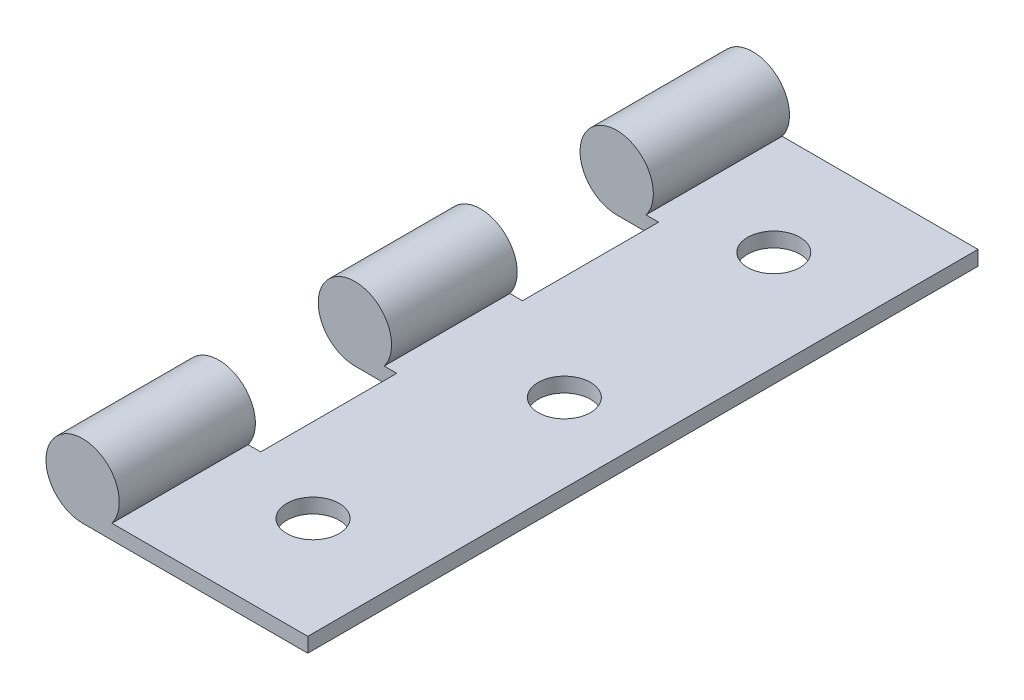
from build123d import *

# Parameters (mm, degrees)
BOSS_EXTRUDE1_DEPTH = 64
SKETCH2_R           = 2.499999953
CUT_EXTRUDE2_DEPTH  = 5
SKETCH3_W           = 8.000000002
SKETCH3_H           = 13
CUT_EXTRUDE3_DEPTH  = 15


with BuildPart() as part:
    # Sketch1 → Boss-Extrude1 (new body)
    with BuildSketch(Plane.XY):
        with BuildLine():
            Line((0, 0), (21.499999926, 0))
            Line((21.499999926, 0), (21.499999926, 1.4))
            Line((21.499999926, 1.4), (2.799999992, 1.4))
            ThreePointArc((2.799999992, 1.4), (-1.565247581, 6.630495138), (0, 0))
        make_face()
    extrude(amount=BOSS_EXTRUDE1_DEPTH)

    # Sketch2 → Cut-Extrude2 (cut)
    with BuildSketch(Plane(origin=(0, 0, 0), x_dir=(1, 0, 0), z_dir=(0, 1, 0))):
        with Locations(Location((11.999999876, -53.99999995, 0), (0, 0, 90))):
            Circle(SKETCH2_R)
        with Locations(Location((13.999999876, -32.000000008, 0), (0, 0, 90))):
            Circle(SKETCH2_R)
        with Locations(Location((11.999999876, -10.000000066, 0), (0, 0, 90))):
            Circle(SKETCH2_R)
    extrude(amount=CUT_EXTRUDE2_DEPTH, mode=Mode.SUBTRACT)

    # Sketch3 → Cut-Extrude3 (cut)
    with BuildSketch(Plane(origin=(0, 0, 0), x_dir=(1, 0, 0), z_dir=(0, 1, 0))):
        with Locations((1e-09, -19.499999908)):
            Rectangle(SKETCH3_W, SKETCH3_H)
        with Locations((1e-09, -44.499999908)):
            Rectangle(SKETCH3_W, SKETCH3_H)
    extrude(amount=CUT_EXTRUDE3_DEPTH, mode=Mode.SUBTRACT)


solid = part.part
